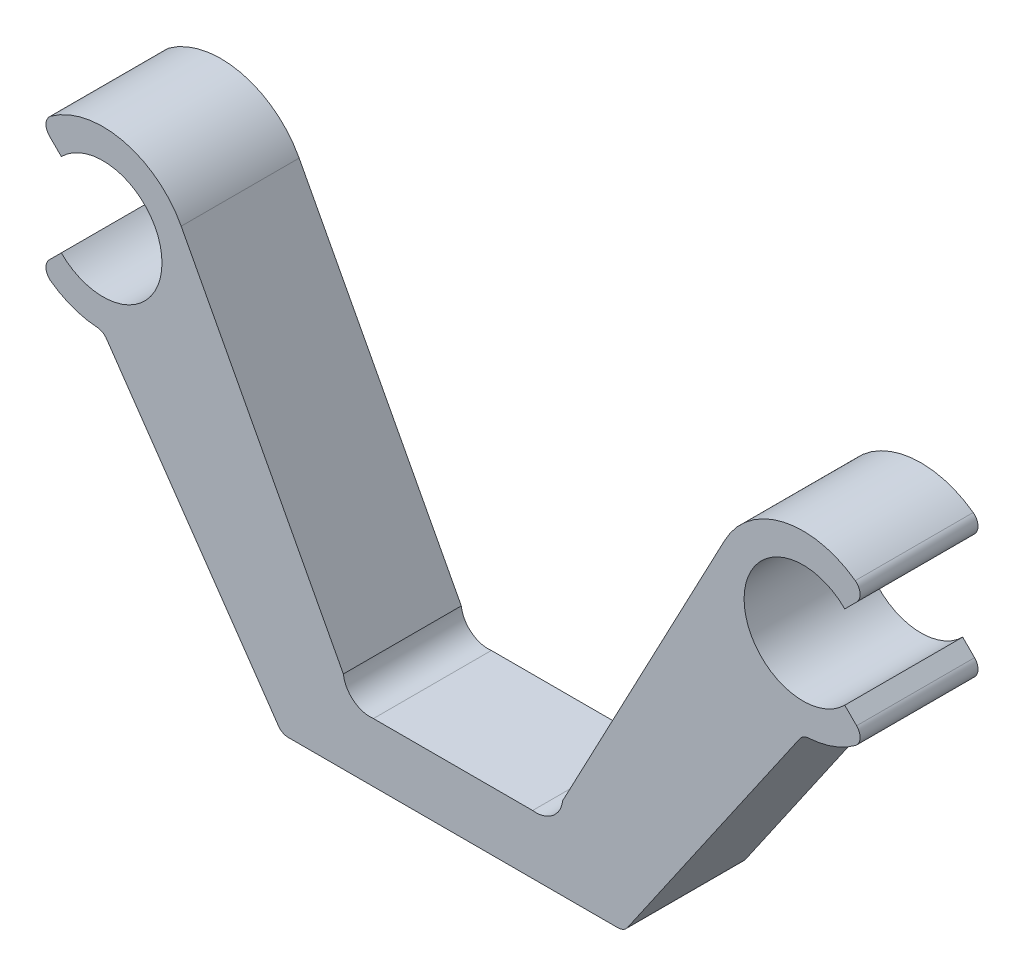
from build123d import *

# Parameters (mm, degrees)
BOSS_EXTRUDE2_DEPTH = 10
SKETCH2_R           = 5
CUT_EXTRUDE1_DEPTH  = 10
SKETCH3_R           = 1.35
CUT_EXTRUDE2_DEPTH  = 3
FILLET1_R           = 1
FILLET2_R           = 1


with BuildPart() as part:
    # Sketch1 → Boss-Extrude2 (new body)
    with BuildSketch(Plane.XY):
        with BuildLine():
            Line((14.5, 0), (-14.5, 0))
            Line((-14.5, 0), (-29.68, 22))
            ThreePointArc((-29.68, 22), (-32.550125743, 22.570903506), (-34.983300859, 24.196699141))
            Line((-34.983300859, 24.196699141), (-29.68, 29.5))
            Line((-29.68, 29.5), (-34.983300859, 34.803300859))
            ThreePointArc((-34.983300859, 34.803300859), (-28.562836183, 36.916329618), (-23.049751963, 33.005682668))
            Line((-23.049751963, 33.005682668), (-9.299486441, 7))
            ThreePointArc((-9.299486441, 7), (-8.438956783, 5.47198407), (-6.75, 5))
            Line((-6.75, 5), (6.75, 5))
            ThreePointArc((6.75, 5), (8.438956783, 5.47198407), (9.299486441, 7))
            Line((9.299486441, 7), (23.049751963, 33.005682668))
            ThreePointArc((23.049751963, 33.005682668), (28.562836183, 36.916329618), (34.983300859, 34.803300859))
            Line((34.983300859, 34.803300859), (29.68, 29.5))
            Line((29.68, 29.5), (34.983300859, 24.196699141))
            ThreePointArc((34.983300859, 24.196699141), (32.550125743, 22.570903506), (29.68, 22))
            Line((29.68, 22), (14.5, 0))
        make_face()
    extrude(amount=BOSS_EXTRUDE2_DEPTH)

    # Sketch2 → Cut-Extrude1 (cut)
    with BuildSketch(Plane.XY.offset(10)):
        with Locations((-29.68, 29.5)):
            Circle(SKETCH2_R)
        with Locations((29.68, 29.5)):
            Circle(SKETCH2_R)
    extrude(amount=-CUT_EXTRUDE1_DEPTH, mode=Mode.SUBTRACT)

    # Sketch3 → Cut-Extrude2 (cut)
    with BuildSketch(Plane.XZ):
        with Locations(Location((-11.75, 5, 0), (0, 0, 270))):
            Circle(SKETCH3_R)
        with Locations(Location((11.75, 5, 0), (0, 0, 270))):
            Circle(SKETCH3_R)
    extrude(amount=-CUT_EXTRUDE2_DEPTH, mode=Mode.SUBTRACT)

    # Fillet1
    fillet1_edges = [part.edges().sort_by_distance(p)[0] for p in [
        (-34.983300859, 24.196699141, 5),
        (-34.983300859, 34.803300859, 5),
    ]]
    fillet(fillet1_edges, radius=FILLET1_R)

    # Fillet2
    fillet2_edges = [part.edges().sort_by_distance(p)[0] for p in [
        (-29.68, 22, 5),
        (34.983300859, 34.803300859, 5),
        (34.983300859, 24.196699141, 5),
        (29.68, 22, 5),
        (14.5, 0, 5),
        (-14.5, 0, 5),
    ]]
    fillet(fillet2_edges, radius=FILLET2_R)


solid = part.part
